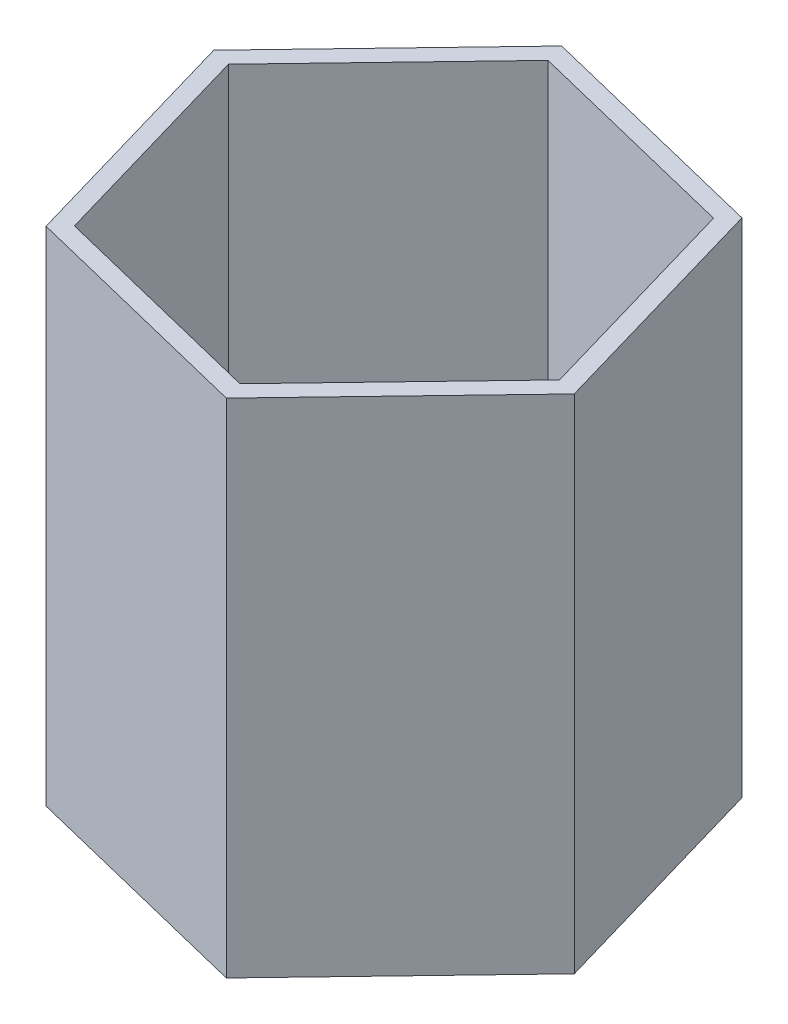
from build123d import *

# Parameters (mm, degrees)
BOSS_EXTRUDE1_DEPTH = 20


with BuildPart() as part:
    # Sketch1 → Boss-Extrude1 (new body)
    with BuildSketch(Plane(origin=(0, 0, 0), x_dir=(1, 0, 0), z_dir=(0, 1, 0))):
        Polygon((6.783544299, 7.072731208), (-2.733392751, 9.411087295), (-9.51693705, 2.338356086), (-6.783544299, -7.072731208), (2.733392751, -9.411087295), (9.51693705, -2.338356086), align=None)
        Polygon((2.510258649, -8.642835271), (8.74004423, -2.147469875), (6.229785581, 6.495365395), (-2.510258649, 8.642835271), (-8.74004423, 2.147469875), (-6.229785581, -6.495365395), align=None, mode=Mode.SUBTRACT)
    extrude(amount=BOSS_EXTRUDE1_DEPTH)


solid = part.part
